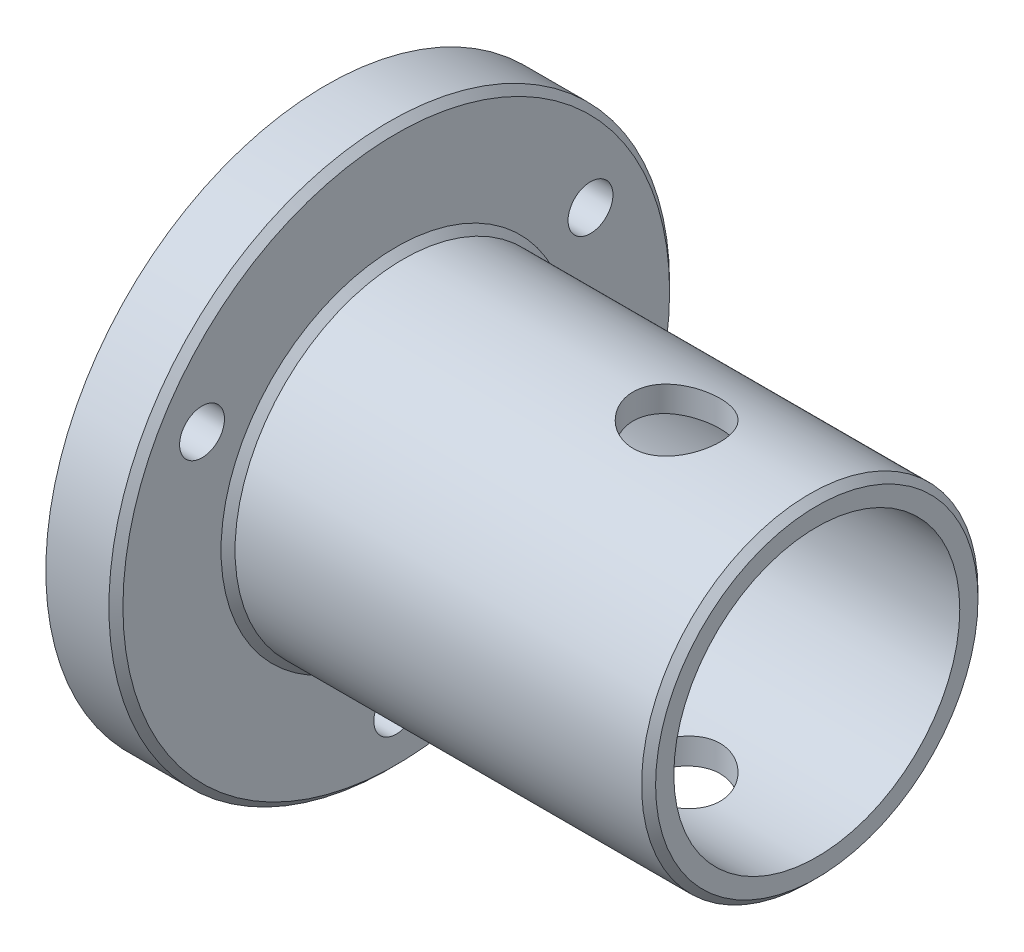
from build123d import *

# Parameters (mm, degrees)
SKETCH_1_R               = 20
EXTRUDE_1_DEPTH          = 5
SKETCH_6_R               = 12
EXTRUDE_2_DEPTH          = 30
SKETCH_7_R               = 10.2
CUT_EXTRUDE_2_DEPTH      = 30
CHAMFER_1_SIZE           = 0.5
CUT_EXTRUDE_3_DEPTH      = 46
CUT_EXTRUDE_3_DEPTH_BACK = 46
SKETCH_8_R               = 3.1
CHAMFER_2_SIZE           = 0.5
CHAMFER_3_SIZE           = 0.5
SKETCH_9_R               = 1.6
CUT_EXTRUDE_4_DEPTH      = 10


with BuildPart() as part:
    # 草图1 → 凸台-拉伸1 (new body)
    with BuildSketch(Plane(origin=(0, 0, 0), x_dir=(0, 0, -1), z_dir=(1, 0, 0))):
        Circle(SKETCH_1_R)
    extrude(amount=EXTRUDE_1_DEPTH)

    # 草图6 → 凸台-拉伸2 (add)
    with BuildSketch(Plane(origin=(5, 0, 0), x_dir=(0, 0, -1), z_dir=(1, 0, 0))):
        Circle(SKETCH_6_R)
    extrude(amount=EXTRUDE_2_DEPTH)

    # 草图7 → 切除-拉伸2 (cut)
    with BuildSketch(Plane(origin=(35, 0, 0), x_dir=(0, 0, -1), z_dir=(1, 0, 0))):
        Circle(SKETCH_7_R)
    extrude(amount=-CUT_EXTRUDE_2_DEPTH, mode=Mode.SUBTRACT)

    # 倒角1
    chamfer_1_edges = [part.edges().sort_by_distance(p)[0] for p in [
        (35, 0, 12),
    ]]
    chamfer(chamfer_1_edges, length=CHAMFER_1_SIZE)

    # 草图8 → 切除-拉伸3 (cut, two sides: drawn at the far end of the back side and taken through both)
    with BuildSketch(Plane(origin=(0, 0, 0), x_dir=(1, 0, 0), z_dir=(0, 1, 0)).offset(-CUT_EXTRUDE_3_DEPTH_BACK)):
        with Locations(Location((25, 0, 0), (0, 0, 90))):
            Circle(SKETCH_8_R)
    extrude(amount=CUT_EXTRUDE_3_DEPTH + CUT_EXTRUDE_3_DEPTH_BACK, mode=Mode.SUBTRACT)

    # 倒角2
    chamfer_2_edges = [part.edges().sort_by_distance(p)[0] for p in [
        (5, 0, 20),
    ]]
    chamfer(chamfer_2_edges, length=CHAMFER_2_SIZE)

    # 倒角3
    chamfer_3_edges = [part.edges().sort_by_distance(p)[0] for p in [
        (5, 0, 12),
    ]]
    chamfer(chamfer_3_edges, length=CHAMFER_3_SIZE)

    # 草图9 → 切除-拉伸4 (cut)
    with BuildSketch(Plane.ZY):
        with Locations((-13.856406461, 8)):
            Circle(SKETCH_9_R)
        with Locations((13.856406461, 8)):
            Circle(SKETCH_9_R)
        with Locations((0, -16)):
            Circle(SKETCH_9_R)
    extrude(amount=-CUT_EXTRUDE_4_DEPTH, mode=Mode.SUBTRACT)


solid = part.part
